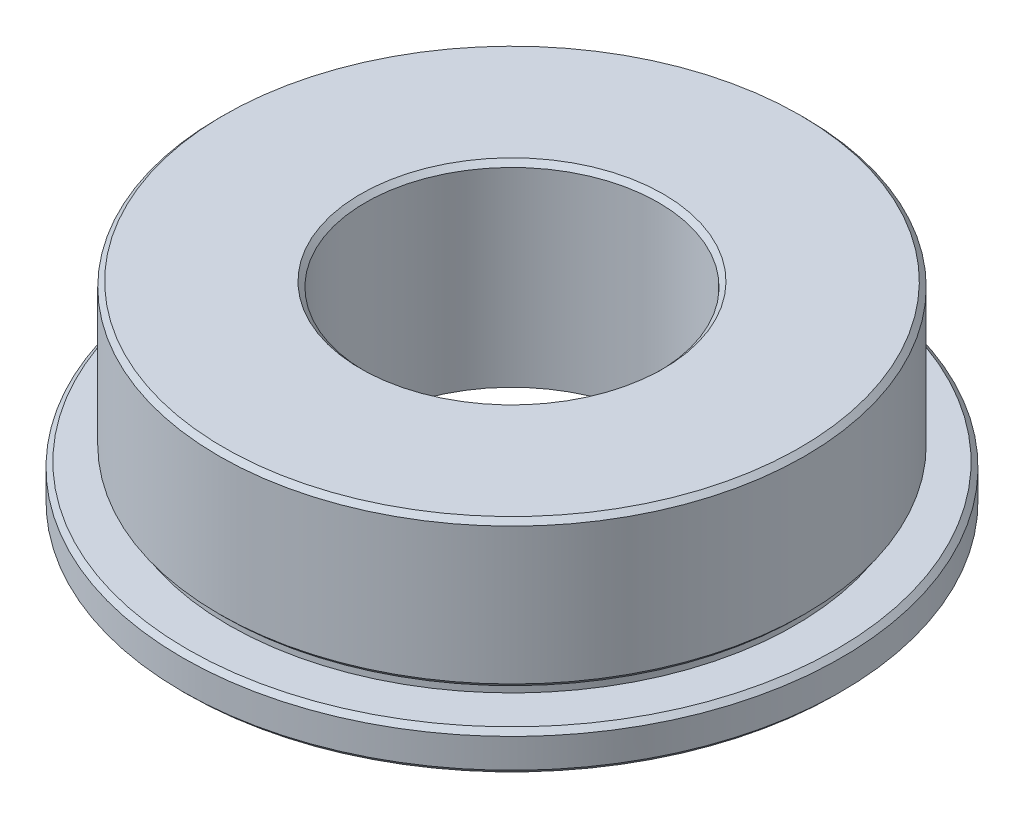
from build123d import *

# Parameters (mm, degrees)
CHAMFER_2_SIZE = 0.1


with BuildPart() as part:
    # 草图2 → 旋转1 (revolve)
    with BuildSketch(Plane.XY, mode=Mode.PRIVATE) as revolve_1_sk:
        Polygon((3, 4), (3, 0), (6.75, 0), (6.75, 0.8), (5.8, 0.8), (5.8, 1), (6, 1), (6, 4), align=None)
    revolve(revolve_1_sk.sketch.rotate(Axis((0, 4, 0), (0, -1, 0)), 90), axis=Axis((0, 4, 0), (0, -1, 0)))

    # 倒角2
    chamfer_2_edges = [part.edges().sort_by_distance(p)[0] for p in [
        (0, 0, -6.75),
        (0, 4, -3),
        (0, 4, -6),
        (0, 1, -6),
        (0, 0.8, -6.75),
    ]]
    chamfer(chamfer_2_edges, length=CHAMFER_2_SIZE)


solid = part.part
